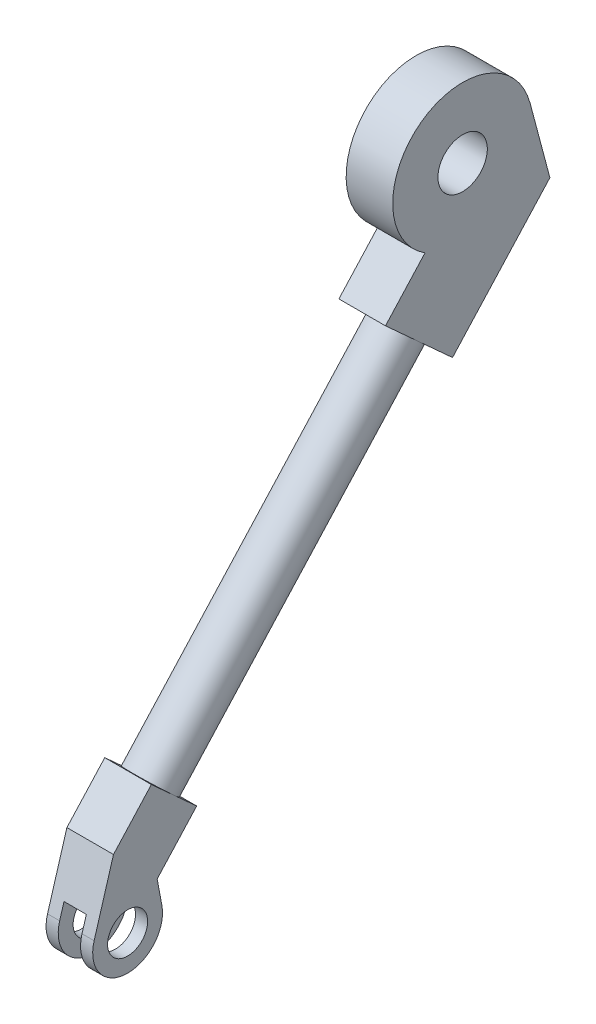
from build123d import *

# Parameters (mm, degrees)
SKETCH2_R               = 7.5
SKETCH2_R_2             = 2.65
BOSS_EXTRUDE1_DEPTH     = 5
BOSS_EXTRUDE2_DEPTH     = 5
SKETCH4_R               = 2.5
BOSS_EXTRUDE3_DEPTH     = 45
BOSS_EXTRUDE4_DEPTH     = 5
CUT_EXTRUDE1_DEPTH      = 116.323136372
CUT_EXTRUDE1_DEPTH_BACK = 116.323136372
SKETCH6_R               = 2.15
SKETCH7_R               = 4.088958129
CUT_EXTRUDE2_DEPTH      = 1.2


with BuildPart() as part:
    # Sketch2 → Boss-Extrude1 (new body)
    with BuildSketch(Plane.ZY.offset(-18.504809472)):
        with Locations((-0.354303453, 100.78821716)):
            Circle(SKETCH2_R)
        with Locations((-0.354303453, 100.78821716)):
            Circle(SKETCH2_R_2, mode=Mode.SUBTRACT)
    extrude(amount=-BOSS_EXTRUDE1_DEPTH)

    # Sketch3 → Boss-Extrude2 (add)
    with BuildSketch(Plane.ZY.offset(-18.504809472)):
        Polygon((-9.150423673, 96.891429681), (-7.602645922, 102.714750693), (0.936612358, 94.575063583), (3.681899885, 94.466899053), (7.922814088, 89.804236476), (0.729824207, 83.261868795), (-9.719499705, 94.750351991), align=None)
    extrude(amount=-BOSS_EXTRUDE2_DEPTH)

    # Sketch4 → Boss-Extrude3 (add)
    with BuildSketch(Plane(origin=(0, 45.202809873, -41.114113503), x_dir=(1, 0, 0), z_dir=(0, -0.7397718400154494, 0.6728578042351567))):
        with Locations(Location((21.004809472, 61.424928866, 0), (0, 0, 180))):
            Circle(SKETCH4_R)
    extrude(amount=BOSS_EXTRUDE3_DEPTH)

    # Sketch5 → Boss-Extrude4 (add)
    with BuildSketch(Plane.ZY.offset(-18.504809472)):
        with BuildLine():
            Line((39.189983074, 48.290417188), (37.112992328, 55.268407542))
            Line((37.112992328, 55.268407542), (33.049229829, 59.736301118))
            Line((33.049229829, 59.736301118), (28.184844411, 55.311910361))
            Line((28.184844411, 55.311910361), (32.423819526, 50.65137971))
            Line((32.423819526, 50.65137971), (31.912552769, 47.90776949))
            ThreePointArc((31.912552769, 47.90776949), (35.794247616, 43.477955415), (39.189983074, 48.290417188))
        make_face()
    extrude(amount=-BOSS_EXTRUDE4_DEPTH)

    # Sketch6 → Cut-Extrude1 (cut, two sides: drawn at the far end of the back side and taken through both)
    with BuildSketch(Plane(origin=(23.504809472, 0, 0), x_dir=(0, 0, -1), z_dir=(1, 0, 0)).offset(-CUT_EXTRUDE1_DEPTH_BACK)):
        with Locations((-35.597432924, 47.221098797)):
            Circle(SKETCH6_R)
    extrude(amount=CUT_EXTRUDE1_DEPTH + CUT_EXTRUDE1_DEPTH_BACK, mode=Mode.SUBTRACT)

    # Sketch7 → Cut-Extrude2 (cut, symmetric)
    with BuildSketch(Plane(origin=(21.004809472, 0, 0), x_dir=(0, 0, -1), z_dir=(1, 0, 0))):
        with Locations((-35.597432924, 47.221098797)):
            Circle(SKETCH7_R)
    extrude(amount=CUT_EXTRUDE2_DEPTH, both=True, mode=Mode.SUBTRACT)


with BuildPart() as part_1:
    # Body-Move/Copy1: moved
    add(part.part.moved(Location((-21, -100.79, 0.35))))


solid = part_1.part
